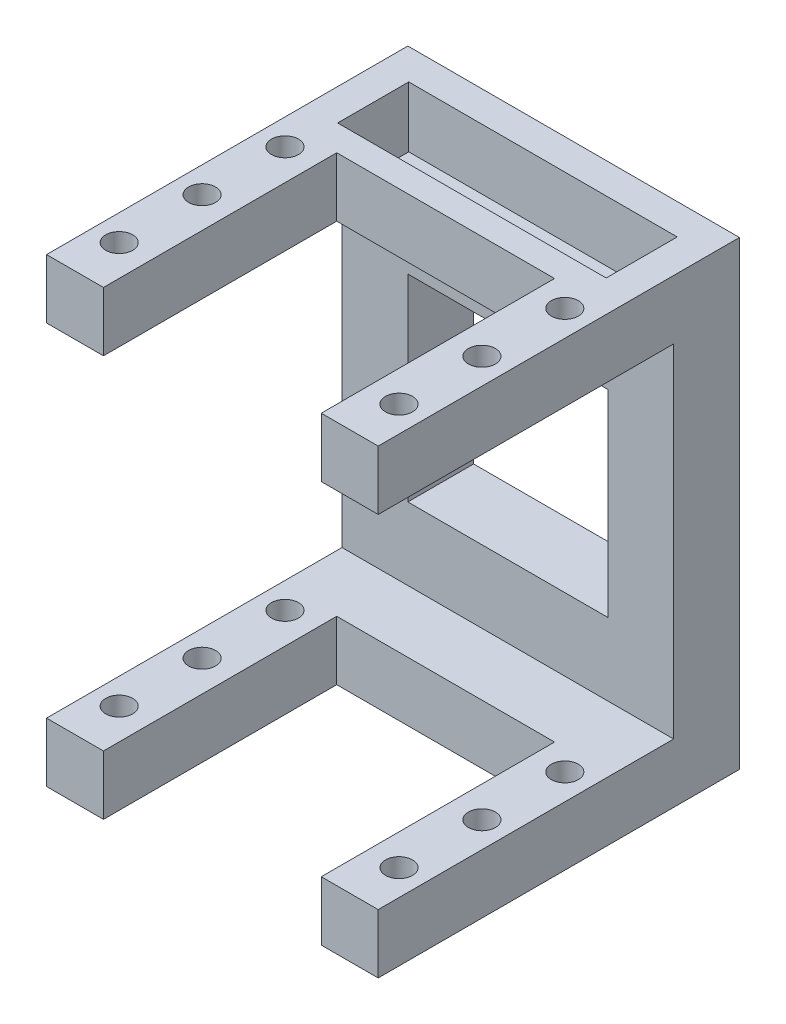
from build123d import *

# Parameters (mm, degrees)
SKETCH1_W           = 32
SKETCH1_H           = 44.45
BOSS_EXTRUDE1_DEPTH = 50.8
SKETCH2_W           = 35.808
SKETCH2_H           = 33.016
CUT_EXTRUDE1_DEPTH  = 32
CUT_EXTRUDE2_REACH  = 71.372
SKETCH4_W           = 8.642
SKETCH4_H           = 44.45
CUT_EXTRUDE3_DEPTH  = 65.020236059
SKETCH6_W           = 25.908
SKETCH6_H           = 6.858
CUT_EXTRUDE4_DEPTH  = 5.842
CUT_EXTRUDE5_START  = -44.45
SKETCH7_R           = 1.3
CUT_EXTRUDE5_DEPTH  = 44.45
SKETCH8_W           = 19.3
SKETCH8_H           = 19.05
CUT_EXTRUDE6_DEPTH  = 45.328667801


with BuildPart() as part:
    # Sketch1 → Boss-Extrude1 (new body)
    with BuildSketch(Plane.XY):
        Rectangle(SKETCH1_W, SKETCH1_H)
    extrude(amount=-BOSS_EXTRUDE1_DEPTH)

    # Sketch2 → Cut-Extrude1 (cut)
    with BuildSketch(Plane(origin=(16, 0, 0), x_dir=(0, 0, -1), z_dir=(1, 0, 0))):
        with Locations((17.904, 0)):
            Rectangle(SKETCH2_W, SKETCH2_H)
    extrude(amount=-CUT_EXTRUDE1_DEPTH, mode=Mode.SUBTRACT)

    # Cut-Extrude2: up to this face of the body (flat: up to its plane)
    cut_extrude2_end = Plane(part.part.faces().sort_by_distance((0, -22.225, -25.4))[0])
    # Sketch3 → Cut-Extrude2 (cut, up to the picked face)
    with BuildSketch(Plane(origin=(0, 22.225, 0), x_dir=(1, 0, 0), z_dir=(0, 1, 0)), mode=Mode.PRIVATE) as cut_extrude2_sk1:
        Polygon((-10.508, 7.3), (-10.508, 29.808), (10.508, 29.808), (10.508, 7.3), (16, 7.3), (16, 0), (-16, 0), (-16, 7.3), align=None)
    cut_extrude2_tool1 = split(extrude(cut_extrude2_sk1.sketch, amount=-CUT_EXTRUDE2_REACH, mode=Mode.PRIVATE), bisect_by=cut_extrude2_end, keep=Keep.BOTH, mode=Mode.PRIVATE)
    add(cut_extrude2_tool1.solids().sort_by(Axis((0, 22.225, -13.626975), (0, -1, 0)))[0], mode=Mode.SUBTRACT)

    # Sketch4 → Cut-Extrude3 (cut, through all)
    with BuildSketch(Plane.ZY.offset(16)):
        with Locations((-46.479, 0)):
            Rectangle(SKETCH4_W, SKETCH4_H)
    extrude(amount=-CUT_EXTRUDE3_DEPTH, mode=Mode.SUBTRACT)

    # Sketch6 → Cut-Extrude4 (cut)
    with BuildSketch(Plane(origin=(0, 22.225, 0), x_dir=(1, 0, 0), z_dir=(0, 1, 0))):
        with Locations((0, 35.771215189)):
            Rectangle(SKETCH6_W, SKETCH6_H)
    extrude(amount=-CUT_EXTRUDE4_DEPTH, mode=Mode.SUBTRACT)

    # Sketch7 → Cut-Extrude5 (cut)
    with BuildSketch(Plane(origin=(0, 22.225, 0), x_dir=(1, 0, 0), z_dir=(0, 1, 0)).offset(CUT_EXTRUDE5_START)):
        with Locations(Location((-13.5, 11.808, 0), (0, 0, 270))):
            Circle(SKETCH7_R)
        with Locations(Location((-13.5, 19.808, 0), (0, 0, 270))):
            Circle(SKETCH7_R)
        with Locations(Location((-13.5, 27.808, 0), (0, 0, 270))):
            Circle(SKETCH7_R)
        with Locations(Location((13.5, 27.808, 0), (0, 0, 270))):
            Circle(SKETCH7_R)
        with Locations(Location((13.5, 19.808, 0), (0, 0, 270))):
            Circle(SKETCH7_R)
        with Locations(Location((13.5, 11.808, 0), (0, 0, 270))):
            Circle(SKETCH7_R)
    extrude(amount=CUT_EXTRUDE5_DEPTH, mode=Mode.SUBTRACT)

    # Sketch8 → Cut-Extrude6 (cut, through all)
    with BuildSketch(Plane(origin=(0, 0, -42.158), x_dir=(-1, 0, 0), z_dir=(0, 0, -1))):
        Rectangle(SKETCH8_W, SKETCH8_H)
    extrude(amount=-CUT_EXTRUDE6_DEPTH, mode=Mode.SUBTRACT)


solid = part.part
